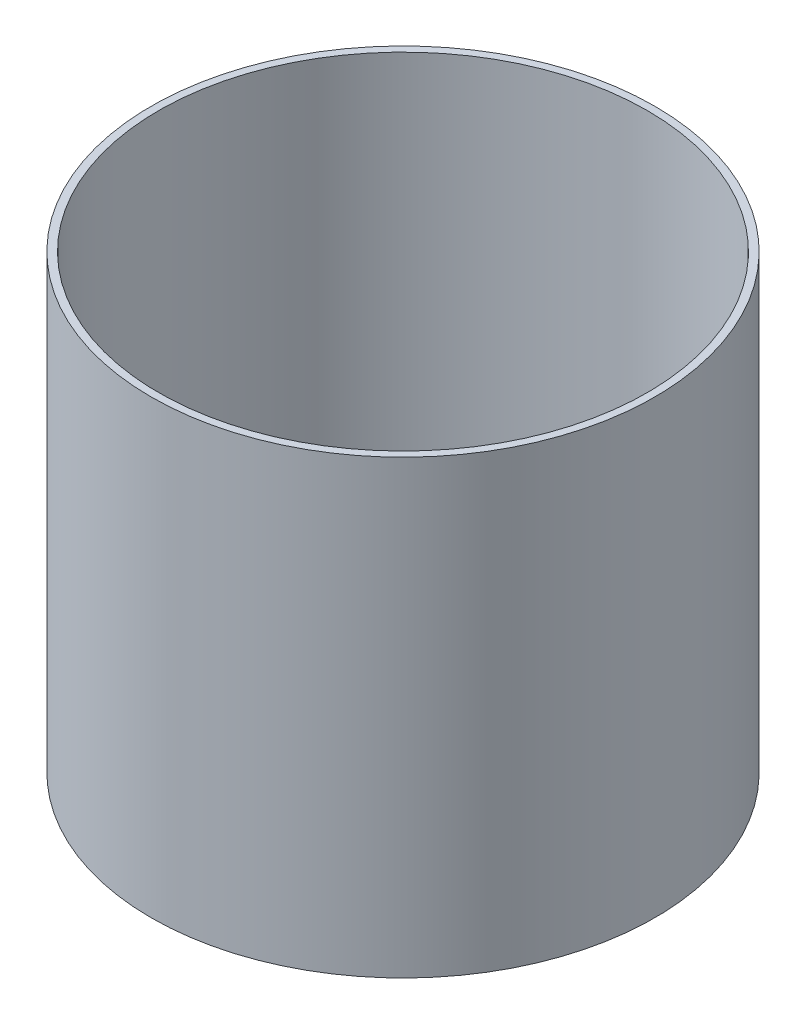
from build123d import *

# Parameters (mm, degrees)
SKETCH1_R           = 85.09
SKETCH1_R_2         = 82.55
BOSS_EXTRUDE1_DEPTH = 152.4


with BuildPart() as part:
    # Sketch1 → Boss-Extrude1 (new body)
    with BuildSketch(Plane(origin=(0, 0, 0), x_dir=(1, 0, 0), z_dir=(0, 1, 0))):
        with Locations(Location((0, 0, 0), (0, 0, 90))):
            Circle(SKETCH1_R)
        with Locations(Location((0, 0, 0), (0, 0, 90))):
            Circle(SKETCH1_R_2, mode=Mode.SUBTRACT)
    extrude(amount=BOSS_EXTRUDE1_DEPTH)


solid = part.part
